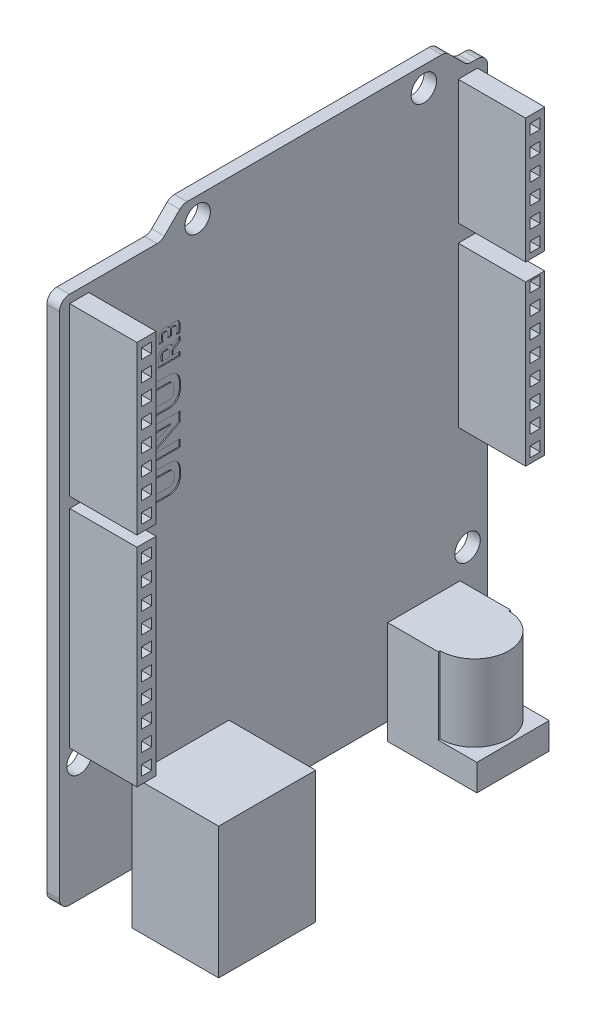
from build123d import *

# Parameters (mm, degrees)
SKETCH1_R                = 1.5875
BOSS_EXTRUDE1_DEPTH      = 1.5748
SKETCH2_W                = 2.3876
SKETCH2_H                = 20.7772
SKETCH2_W_2              = 1.27
SKETCH2_H_2              = 1.27
BOSS_EXTRUDE2_DEPTH      = 8.382
LPATTERN1_COUNT          = 2
LPATTERN1_PITCH          = 22.098
SKETCH3_W                = 8.382
SKETCH3_H                = 2.3876
BOSS_EXTRUDE3_DEPTH      = 5.08
SKETCH4_W                = 1.27
SKETCH4_H                = 1.27
CUT_EXTRUDE1_DEPTH       = 8.382
SKETCH5_W                = 2.3876
SKETCH5_H                = 5.252717845
CUT_EXTRUDE2_DEPTH       = 8.382
SKETCH6_W                = 8.382
SKETCH6_H                = 2.3876
BOSS_EXTRUDE4_DEPTH      = 4.414517846
SKETCH7_W                = 1.27
SKETCH7_H                = 1.27
CUT_EXTRUDE3_DEPTH       = 8.382
SKETCH8_W                = 2.3876
SKETCH8_H                = 5.3086
CUT_EXTRUDE4_DEPTH       = 8.382
BOSS_EXTRUDE5_DEPTH      = 2.159
BOSS_EXTRUDE5_DEPTH_BACK = 1.143
SKETCH9_W                = 11.0998
SKETCH9_H                = 9.017
SKETCH9_R                = 3.175
SKETCH9_R_2              = 0.635
BOSS_EXTRUDE6_DEPTH      = 9.525
BOSS_EXTRUDE7_DEPTH      = 6.35
BOSS_EXTRUDE7_DEPTH_BACK = 10.033
SKETCH11_W               = 10.795
SKETCH11_H               = 12.065
SKETCH12_W               = 3.048
SKETCH12_H               = 5.588
CUT_EXTRUDE5_DEPTH       = 9.144
CUT_EXTRUDE6_DEPTH       = 0.127


with BuildPart() as part:
    # Sketch1 → Boss-Extrude1 (new body)
    with BuildSketch(Plane(origin=(0, 0, 0), x_dir=(0, 0, -1), z_dir=(1, 0, 0))):
        with BuildLine():
            Line((-25.4, 29.380469799), (-14.496051224, 29.380469799))
            ThreePointArc((-14.496051224, 29.380469799), (-14.010043265, 29.477142792), (-13.598025612, 29.752444187))
            Line((-13.598025612, 29.752444187), (-11.674974388, 31.675495411))
            ThreePointArc((-11.674974388, 31.675495411), (-11.262956735, 31.950796805), (-10.776948776, 32.047469799))
            Line((-10.776948776, 32.047469799), (20.936948776, 32.047469799))
            ThreePointArc((20.936948776, 32.047469799), (21.422956735, 31.950796805), (21.834974388, 31.675495411))
            Line((21.834974388, 31.675495411), (23.758025612, 29.752444187))
            ThreePointArc((23.758025612, 29.752444187), (24.170043265, 29.477142792), (24.656051224, 29.380469799))
            Line((24.656051224, 29.380469799), (25.4, 29.380469799))
            ThreePointArc((25.4, 29.380469799), (26.298025612, 29.008495411), (26.67, 28.110469799))
            Line((26.67, 28.110469799), (26.67, -35.262530201))
            ThreePointArc((26.67, -35.262530201), (26.298025612, -36.160555813), (25.4, -36.532530201))
            Line((25.4, -36.532530201), (-25.4, -36.532530201))
            ThreePointArc((-25.4, -36.532530201), (-26.298025612, -36.160555813), (-26.67, -35.262530201))
            Line((-26.67, -35.262530201), (-26.67, 28.110469799))
            ThreePointArc((-26.67, 28.110469799), (-26.298025612, 29.008495411), (-25.4, 29.380469799))
        make_face()
        with Locations((18.7325, 29.545569799)):
            Circle(SKETCH1_R, mode=Mode.SUBTRACT)
        with Locations((-9.4615, 29.545569799)):
            Circle(SKETCH1_R, mode=Mode.SUBTRACT)
        with Locations((24.1681, -22.702230201)):
            Circle(SKETCH1_R, mode=Mode.SUBTRACT)
        with Locations((-24.1681, -21.432230201)):
            Circle(SKETCH1_R, mode=Mode.SUBTRACT)
    extrude(amount=BOSS_EXTRUDE1_DEPTH)

    # Sketch2 → Boss-Extrude2 (add)
    # profile 1 of 2: a face of its own
    with BuildSketch(Plane(origin=(1.5748, 0, 0), x_dir=(0, 0, -1), z_dir=(1, 0, 0))):
        with Locations((-24.2062, 17.975869799)):
            Rectangle(SKETCH2_W, SKETCH2_H)
        with Locations((-24.2062, 24.325869799)):
            Rectangle(SKETCH2_W_2, SKETCH2_H_2, mode=Mode.SUBTRACT)
        with Locations((-24.2062, 26.865869799)):
            Rectangle(SKETCH2_W_2, SKETCH2_H_2, mode=Mode.SUBTRACT)
        with Locations((-24.2062, 21.785869799)):
            Rectangle(SKETCH2_W_2, SKETCH2_H_2, mode=Mode.SUBTRACT)
        with Locations((-24.2062, 19.245869799)):
            Rectangle(SKETCH2_W_2, SKETCH2_H_2, mode=Mode.SUBTRACT)
        with Locations((-24.2062, 16.705869799)):
            Rectangle(SKETCH2_W_2, SKETCH2_H_2, mode=Mode.SUBTRACT)
        with Locations((-24.2062, 14.165869799)):
            Rectangle(SKETCH2_W_2, SKETCH2_H_2, mode=Mode.SUBTRACT)
        with Locations((-24.2062, 11.625869799)):
            Rectangle(SKETCH2_W_2, SKETCH2_H_2, mode=Mode.SUBTRACT)
        with Locations((-24.2062, 9.085869799)):
            Rectangle(SKETCH2_W_2, SKETCH2_H_2, mode=Mode.SUBTRACT)
    # profile 2 of 2: a face of its own
    with BuildSketch(Plane(origin=(1.5748, 0, 0), x_dir=(0, 0, -1), z_dir=(1, 0, 0))):
        with Locations((24.2062, 17.975869799)):
            Rectangle(SKETCH2_W, SKETCH2_H)
        with Locations((24.2062, 24.325869799)):
            Rectangle(SKETCH2_W_2, SKETCH2_H_2, mode=Mode.SUBTRACT)
        with Locations((24.2062, 26.865869799)):
            Rectangle(SKETCH2_W_2, SKETCH2_H_2, mode=Mode.SUBTRACT)
        with Locations((24.2062, 21.785869799)):
            Rectangle(SKETCH2_W_2, SKETCH2_H_2, mode=Mode.SUBTRACT)
        with Locations((24.2062, 19.245869799)):
            Rectangle(SKETCH2_W_2, SKETCH2_H_2, mode=Mode.SUBTRACT)
        with Locations((24.2062, 16.705869799)):
            Rectangle(SKETCH2_W_2, SKETCH2_H_2, mode=Mode.SUBTRACT)
        with Locations((24.2062, 14.165869799)):
            Rectangle(SKETCH2_W_2, SKETCH2_H_2, mode=Mode.SUBTRACT)
        with Locations((24.2062, 11.625869799)):
            Rectangle(SKETCH2_W_2, SKETCH2_H_2, mode=Mode.SUBTRACT)
        with Locations((24.2062, 9.085869799)):
            Rectangle(SKETCH2_W_2, SKETCH2_H_2, mode=Mode.SUBTRACT)
    boss_extrude2 = extrude(amount=BOSS_EXTRUDE2_DEPTH)

    # LPattern1: Boss-Extrude2 ×2
    with Locations(*[(0, -i * LPATTERN1_PITCH, 0) for i in range(1, LPATTERN1_COUNT)]):
        add(boss_extrude2)

    # Sketch3 → Boss-Extrude3 (add)
    with BuildSketch(Plane.XZ.offset(14.510730201)):
        with Locations((5.7658, 24.2062)):
            Rectangle(SKETCH3_W, SKETCH3_H)
    extrude(amount=BOSS_EXTRUDE3_DEPTH)

    # Sketch4 → Cut-Extrude1 (cut)
    with BuildSketch(Plane(origin=(9.9568, 0, 0), x_dir=(0, 0, -1), z_dir=(1, 0, 0))):
        with Locations((-24.2062, -15.552130201)):
            Rectangle(SKETCH4_W, SKETCH4_H)
        with Locations((-24.2062, -18.092130201)):
            Rectangle(SKETCH4_W, SKETCH4_H)
    extrude(amount=-CUT_EXTRUDE1_DEPTH, mode=Mode.SUBTRACT)

    # Sketch5 → Cut-Extrude2 (cut)
    with BuildSketch(Plane(origin=(9.9568, 0, 0), x_dir=(0, 0, -1), z_dir=(1, 0, 0))):
        with Locations((24.2062, 10.213628722)):
            Rectangle(SKETCH5_W, SKETCH5_H)
    extrude(amount=-CUT_EXTRUDE2_DEPTH, mode=Mode.SUBTRACT)

    # Sketch6 → Boss-Extrude4 (add)
    with BuildSketch(Plane(origin=(0, 6.266469799, 0), x_dir=(1, 0, 0), z_dir=(0, 1, 0))):
        with Locations((5.7658, 24.2062)):
            Rectangle(SKETCH6_W, SKETCH6_H)
    extrude(amount=BOSS_EXTRUDE4_DEPTH)

    # Sketch7 → Cut-Extrude3 (cut)
    with BuildSketch(Plane(origin=(9.9568, 0, 0), x_dir=(0, 0, -1), z_dir=(1, 0, 0))):
        with Locations((24.2062, 7.307869799)):
            Rectangle(SKETCH7_W, SKETCH7_H)
        with Locations((24.2062, 9.847869799)):
            Rectangle(SKETCH7_W, SKETCH7_H)
    extrude(amount=-CUT_EXTRUDE3_DEPTH, mode=Mode.SUBTRACT)

    # Sketch8 → Cut-Extrude4 (cut)
    with BuildSketch(Plane(origin=(9.9568, 0, 0), x_dir=(0, 0, -1), z_dir=(1, 0, 0))):
        with Locations((24.2062, -11.856430201)):
            Rectangle(SKETCH8_W, SKETCH8_H)
    extrude(amount=-CUT_EXTRUDE4_DEPTH, mode=Mode.SUBTRACT)

    # Sketch9 → Boss-Extrude5 (add, two sides: drawn at the far end of the back side and taken through both)
    # profile 1 of 2: a face of its own
    with BuildSketch(Plane.XZ.offset(36.532530201).offset(-BOSS_EXTRUDE5_DEPTH_BACK)):
        with Locations((7.1247, -18.7325)):
            Rectangle(SKETCH9_W, SKETCH9_H)
        with Locations(Location((7.874, -18.7325, 0), (0, 0, 270))):
            Circle(SKETCH9_R, mode=Mode.SUBTRACT)
    # profile 2 of 2: a face of its own
    with BuildSketch(Plane.XZ.offset(36.532530201).offset(-BOSS_EXTRUDE5_DEPTH_BACK)):
        with Locations(Location((7.874, -18.7325, 0), (0, 0, 270))):
            Circle(SKETCH9_R_2)
    extrude(amount=BOSS_EXTRUDE5_DEPTH + BOSS_EXTRUDE5_DEPTH_BACK)


with BuildPart() as boss_extrude5_piece_1:
    # of the separate pieces the step leaves, piece 1, a body of its own (boss_extrude5_pieces)
    add(part.part.solids().sort_by_distance((0, -35.262530201, 26.67))[0])



with BuildPart() as boss_extrude5_piece_2:
    # of the separate pieces the step leaves, piece 2, a body of its own (boss_extrude5_pieces)
    add(part.part.solids().sort_by_distance((7.874, -36.532530201, -19.3675))[0])


with BuildPart() as boss_extrude5_piece_1_1:
    add(boss_extrude5_piece_1.part)

    add(boss_extrude5_piece_2.part)  # Boss-Extrude6 merges Boss-Extrude5 piece 2
    # Sketch10 → Boss-Extrude6 (add)
    with BuildSketch(Plane(origin=(0, -35.389530201, 0), x_dir=(1, 0, 0), z_dir=(0, 1, 0))):
        with BuildLine():
            Line((7.874, 23.241), (1.5748, 23.241))
            Line((1.5748, 23.241), (1.5748, 14.224))
            Line((1.5748, 14.224), (7.874, 14.224))
            Line((7.874, 14.224), (7.874, 14.4526))
            ThreePointArc((7.874, 14.4526), (12.1539, 18.7325), (7.874, 23.0124))
            Line((7.874, 23.0124), (7.874, 23.241))
        make_face()
    extrude(amount=BOSS_EXTRUDE6_DEPTH)

    # Sketch11 → Boss-Extrude7 (add, two sides: drawn at the far end of the back side and taken through both)
    with BuildSketch(Plane.XZ.offset(36.532530201).offset(-BOSS_EXTRUDE7_DEPTH_BACK)):
        with Locations((6.9723, 11.5951)):
            Rectangle(SKETCH11_W, SKETCH11_H)
    extrude(amount=BOSS_EXTRUDE7_DEPTH + BOSS_EXTRUDE7_DEPTH_BACK)

    # Sketch12 → Cut-Extrude5 (cut)
    with BuildSketch(Plane.XZ.offset(42.882530201)):
        Polygon((3.3528, 15.8496), (3.3528, 7.3406), (8.9408, 7.3406), (11.0998, 9.4996), (11.0998, 13.6906), (8.9408, 15.8496), align=None)
        with Locations((7.2263, 11.5951)):
            Rectangle(SKETCH12_W, SKETCH12_H, mode=Mode.SUBTRACT)
    extrude(amount=-CUT_EXTRUDE5_DEPTH, mode=Mode.SUBTRACT)

    # Sketch13 → Cut-Extrude6 (cut)
    # profile 1 of 5: a face of its own
    with BuildSketch(Plane(origin=(1.5748, 0, 0), x_dir=(0, 0, -1), z_dir=(1, 0, 0))):
        with BuildLine():
            Line((-16.40418539, 4.076653632), (-13.090824439, 4.082271085))
            add(Edge.make_bspline(
                [(-13.090824439, 4.082271085), (-13.062772283, 4.081770767), (-13.007698506, 4.08078851), (-12.927417633, 4.074398088), (-12.851959787, 4.059377479), (-12.781451069, 4.038986256), (-12.715794501, 4.011983852), (-12.655279387, 3.978737583), (-12.600057551, 3.939079129), (-12.54939075, 3.893051575), (-12.504657413, 3.838773297), (-12.466196867, 3.775987512), (-12.434329045, 3.70478736), (-12.407474606, 3.625397291), (-12.385487075, 3.537559883), (-12.371980641, 3.44072242), (-12.362360933, 3.335675572), (-12.360549862, 3.262695941), (-12.359607191, 3.224709678)],
                knots=[0, 0, 0, 0, 1.036768829, 2.035450589, 2.970817006, 3.874706733, 4.743834239, 5.588575961, 6.420221623, 7.250595281, 8.111072666, 9.010001133, 9.963021592, 10.987346692, 12.103888637, 13.303221002, 14.596313033, 16, 16, 16, 16], degree=3))
            add(Edge.make_bspline(
                [(-12.359607191, 3.224709678), (-12.360109464, 3.18672103), (-12.361074571, 3.113726702), (-12.371031456, 3.008352007), (-12.384502403, 2.911619152), (-12.405503525, 2.823292235), (-12.432087884, 2.743879388), (-12.464131158, 2.672394919), (-12.502599185, 2.60963015), (-12.547269011, 2.555260775), (-12.598323729, 2.509427731), (-12.652839516, 2.468434146), (-12.713541668, 2.43569978), (-12.778577073, 2.408125354), (-12.848867153, 2.387928877), (-12.924371247, 2.373292098), (-13.004773083, 2.365058932), (-13.060159507, 2.364592282), (-13.088476756, 2.3643537)],
                knots=[0, 0, 0, 0, 1.401962011, 2.693838237, 3.90464286, 5.004750184, 6.040174875, 6.992299275, 7.890382541, 8.750050878, 9.579643793, 10.417995117, 11.261942587, 12.118489834, 13.021529696, 13.956016653, 14.954978808, 16, 16, 16, 16], degree=3))
            Line((-13.088476756, 2.3643537), (-16.401273535, 2.359144716))
            Line((-16.401273535, 2.359144716), (-16.399744812, 1.457452535))
            Line((-16.399744812, 1.457452535), (-13.014820989, 1.463191315))
            add(Edge.make_bspline(
                [(-13.014820989, 1.463191315), (-12.966853572, 1.463036625), (-12.872657858, 1.462732853), (-12.733739321, 1.479232635), (-12.599670999, 1.506562947), (-12.470739862, 1.548448765), (-12.346810441, 1.602880922), (-12.22712498, 1.668686427), (-12.114153614, 1.75000039), (-12.004530867, 1.841176239), (-11.903806044, 1.949650865), (-11.816817506, 2.077658823), (-11.741634575, 2.223885724), (-11.682208628, 2.389341281), (-11.631618785, 2.571841124), (-11.596396573, 2.773278425), (-11.574015792, 2.993365906), (-11.568418706, 3.146316291), (-11.565512082, 3.225745004)],
                knots=[0, 0, 0, 0, 0.886673269, 1.741199073, 2.582650024, 3.41450301, 4.24363194, 5.083895205, 5.935936917, 6.814732091, 7.718362947, 8.664049487, 9.669161808, 10.751937351, 11.910496383, 13.169091037, 14.529879771, 16, 16, 16, 16], degree=3))
            add(Edge.make_bspline(
                [(-11.565512082, 3.225745004), (-11.568201262, 3.305189777), (-11.573370546, 3.457902696), (-11.598585977, 3.677573493), (-11.635721323, 3.87850108), (-11.682643847, 4.062029728), (-11.74687213, 4.225568247), (-11.820799105, 4.371777075), (-11.907904731, 4.500171812), (-12.009808698, 4.607774419), (-12.11901507, 4.700000539), (-12.233401318, 4.778921949), (-12.35212662, 4.845787682), (-12.476029058, 4.900390848), (-12.605797176, 4.940303433), (-12.739915119, 4.968208611), (-12.878924447, 4.984698927), (-12.973166497, 4.984056169), (-13.02118056, 4.9837287)],
                knots=[0, 0, 0, 0, 1.470244897, 2.826182015, 4.086032713, 5.249185149, 6.324647945, 7.3298455, 8.275612236, 9.183662708, 10.062532404, 10.916223785, 11.750984813, 12.580184055, 13.416262704, 14.257785011, 15.112383279, 16, 16, 16, 16], degree=3))
            Line((-13.02118056, 4.9837287), (-16.405714114, 4.978345813))
            Line((-16.405714114, 4.978345813), (-16.40418539, 4.076653632))
        make_face()
    # profile 2 of 5: a face of its own
    with BuildSketch(Plane(origin=(1.5748, 0, 0), x_dir=(0, 0, -1), z_dir=(1, 0, 0))):
        Polygon((-11.644466518, 8.697813219), (-11.646504816, 9.900069461), (-16.412592059, 9.891989064), (-16.411099734, 9.011765745), (-12.790018435, 9.017904905), (-16.408030154, 7.201225095), (-16.405991855, 5.998968854), (-11.639904612, 6.00704925), (-11.641396938, 6.88727257), (-15.255321949, 6.881145543), align=None)
    # profile 3 of 5: a face of its own
    with BuildSketch(Plane(origin=(1.5748, 0, 0), x_dir=(0, 0, -1), z_dir=(1, 0, 0))):
        with BuildLine():
            add(Edge.make_bspline(
                [(-15.023271978, 14.470319686), (-15.073638817, 14.469996741), (-15.172368099, 14.469363701), (-15.317182843, 14.450962491), (-15.455730255, 14.420795878), (-15.588973861, 14.379235728), (-15.714808804, 14.320773919), (-15.835629374, 14.252044861), (-15.948979358, 14.167658881), (-16.057385101, 14.071882397), (-16.157018407, 13.959282829), (-16.243001647, 13.827687643), (-16.315203832, 13.677632997), (-16.376563087, 13.510325215), (-16.423184965, 13.324171867), (-16.458041253, 13.120319482), (-16.480842032, 12.898236319), (-16.485579016, 12.743889796), (-16.48803798, 12.663768682)],
                knots=[0, 0, 0, 0, 0.913462901, 1.79057365, 2.643189391, 3.485039204, 4.317540177, 5.156589261, 6.003457043, 6.877319016, 7.778237269, 8.723275687, 9.720507335, 10.79450682, 11.952098766, 13.198074651, 14.545523574, 16, 16, 16, 16], degree=3))
            add(Edge.make_bspline(
                [(-16.48803798, 12.663768682), (-16.485269926, 12.583980676), (-16.47992568, 12.429934967), (-16.455580598, 12.208354636), (-16.421574057, 12.004196178), (-16.373063135, 11.818453788), (-16.312398029, 11.65064921), (-16.238950541, 11.501301885), (-16.152634865, 11.370135167), (-16.05316867, 11.257845299), (-15.945114339, 11.161416574), (-15.830145518, 11.079221761), (-15.709810411, 11.009073038), (-15.582734692, 10.953616347), (-15.450378519, 10.908769401), (-15.311158377, 10.881088797), (-15.166397429, 10.863336), (-15.067971163, 10.863336409), (-15.017874936, 10.863336617)],
                knots=[0, 0, 0, 0, 1.44910639, 2.797771635, 4.04426638, 5.203915865, 6.278362595, 7.278780301, 8.218985791, 9.120279213, 9.994505087, 10.843114719, 11.682513208, 12.518513546, 13.356694972, 14.214485498, 15.091222876, 16, 16, 16, 16], degree=3))
            Line((-15.017874936, 10.863336617), (-13.042021829, 10.866899594))
            add(Edge.make_bspline(
                [(-13.042021829, 10.866899594), (-12.992074862, 10.8666451), (-12.893753183, 10.866144122), (-12.749379008, 10.884951453), (-12.610828835, 10.914999563), (-12.477585907, 10.956590683), (-12.351750948, 11.015044386), (-12.23092977, 11.083775324), (-12.117582286, 11.168161946), (-12.009166756, 11.263933755), (-11.909571953, 11.376552318), (-11.823263907, 11.508331633), (-11.751613893, 11.659009078), (-11.690146965, 11.82621187), (-11.643091414, 12.012279035), (-11.608657209, 12.216216496), (-11.58572813, 12.438270372), (-11.580980865, 12.592273964), (-11.578521675, 12.672051291)],
                knots=[0, 0, 0, 0, 0.906092042, 1.783661674, 2.636723482, 3.47901373, 4.311950247, 5.151438301, 5.998749144, 6.873068299, 7.774457891, 8.71999073, 9.723376461, 10.797937837, 11.95006692, 13.20286967, 14.551023545, 16, 16, 16, 16], degree=3))
            add(Edge.make_bspline(
                [(-11.578521675, 12.672051291), (-11.581449699, 12.752163835), (-11.587089761, 12.906479404), (-11.609204188, 13.128708495), (-11.645447586, 13.332509682), (-11.693119113, 13.518182079), (-11.754711058, 13.685626412), (-11.827277952, 13.835368614), (-11.913965665, 13.966699341), (-12.013377172, 14.079023393), (-12.121461008, 14.175406375), (-12.236366338, 14.257745951), (-12.357045114, 14.32743963), (-12.483341033, 14.384842123), (-12.616438278, 14.427674291), (-12.755359398, 14.45588582), (-12.900173242, 14.473487913), (-12.998592208, 14.473508304), (-13.048684719, 14.473518682)],
                knots=[0, 0, 0, 0, 1.454725837, 2.802143478, 4.049176214, 5.208316077, 6.276411913, 7.28200375, 8.221796055, 9.122693393, 9.996535077, 10.844771777, 11.683801382, 12.521988963, 13.357856606, 14.215270164, 15.091622249, 16, 16, 16, 16], degree=3))
            Line((-13.048684719, 14.473518682), (-15.023271978, 14.470319686))
        make_face()
        with BuildLine():
            add(Edge.make_bspline(
                [(-14.968591797, 11.765328072), (-14.99642465, 11.76503768), (-15.05030174, 11.764475556), (-15.128963497, 11.772897171), (-15.202492627, 11.788981108), (-15.272325738, 11.808907093), (-15.337092166, 11.837051604), (-15.396424395, 11.87286686), (-15.451536064, 11.914204034), (-15.502077051, 11.962428138), (-15.547232867, 12.01884782), (-15.58499106, 12.084932546), (-15.618820507, 12.15917695), (-15.645035954, 12.243093377), (-15.665461403, 12.335991959), (-15.680980533, 12.437297552), (-15.69004206, 12.547999551), (-15.691925049, 12.624754974), (-15.692907545, 12.664804008)],
                knots=[0, 0, 0, 0, 1.005017582, 1.945449934, 2.85024458, 3.722050096, 4.565210484, 5.392738205, 6.220641562, 7.049577042, 7.910255726, 8.821214826, 9.79222772, 10.852918712, 11.990277154, 13.226407482, 14.552809739, 16, 16, 16, 16], degree=3))
            add(Edge.make_bspline(
                [(-15.692907545, 12.664804008), (-15.692401918, 12.70486309), (-15.691428403, 12.781991309), (-15.681522525, 12.892869844), (-15.668163833, 12.995245101), (-15.64574852, 13.087638379), (-15.620765276, 13.172180432), (-15.587264745, 13.246504093), (-15.549292403, 13.312823589), (-15.504149859, 13.369250322), (-15.453608411, 13.417481954), (-15.398486138, 13.458782692), (-15.339197017, 13.494737043), (-15.274474482, 13.522256817), (-15.205523069, 13.544242201), (-15.132028928, 13.559758853), (-15.053613497, 13.567942666), (-14.999947522, 13.568405446), (-14.972320588, 13.568643682)],
                knots=[0, 0, 0, 0, 1.446325069, 2.784698753, 4.018586844, 5.170492991, 6.215179291, 7.197240573, 8.107891679, 8.968279368, 9.796934586, 10.62455803, 11.451805965, 12.294681281, 13.15795316, 14.062441895, 15.002556289, 16, 16, 16, 16], degree=3))
            Line((-14.972320588, 13.568643682), (-13.09670201, 13.571891209))
            add(Edge.make_bspline(
                [(-13.09670201, 13.571891209), (-13.069292602, 13.571999602), (-13.015498233, 13.572212336), (-12.936904133, 13.564043685), (-12.863320195, 13.548051196), (-12.793956183, 13.527729516), (-12.729460592, 13.499826215), (-12.670137169, 13.463982432), (-12.615022796, 13.42265294), (-12.564483895, 13.374426447), (-12.519322142, 13.318008672), (-12.481587406, 13.251918373), (-12.447661019, 13.177696401), (-12.421831733, 13.093611334), (-12.399685601, 13.001030401), (-12.384588744, 12.899191937), (-12.375496371, 12.788168803), (-12.373601217, 12.711066558), (-12.372616784, 12.671015965)],
                knots=[0, 0, 0, 0, 0.989796482, 1.942598557, 2.847365444, 3.70720455, 4.55033907, 5.377841403, 6.205719361, 7.034629411, 7.895281689, 8.806212843, 9.777195947, 10.837854398, 11.977976466, 13.214068871, 14.552854137, 16, 16, 16, 16], degree=3))
            add(Edge.make_bspline(
                [(-12.372616784, 12.671015965), (-12.373172186, 12.630965315), (-12.374241535, 12.553853331), (-12.383491085, 12.442812512), (-12.399033333, 12.34117523), (-12.419405491, 12.248247876), (-12.445929167, 12.164126522), (-12.479220033, 12.089293928), (-12.517285809, 12.023002413), (-12.562404079, 11.966565792), (-12.612956554, 11.91834744), (-12.668057871, 11.877003338), (-12.727149112, 11.841373793), (-12.791575164, 11.81317558), (-12.860634335, 11.791483201), (-12.934660089, 11.777418416), (-13.012929662, 11.76882296), (-13.066606527, 11.768419378), (-13.094239067, 11.768211617)],
                knots=[0, 0, 0, 0, 1.44627833, 2.784608763, 4.020281224, 5.157218384, 6.217516492, 7.199546038, 8.110167716, 8.970527601, 9.799156041, 10.62675274, 11.453973941, 12.285409713, 13.160538882, 14.062504509, 15.002588522, 16, 16, 16, 16], degree=3))
            Line((-13.094239067, 11.768211617), (-14.968591797, 11.765328072))
        make_face(mode=Mode.SUBTRACT)
    # profile 4 of 5: a face of its own
    with BuildSketch(Plane(origin=(1.5748, 0, 0), x_dir=(0, 0, -1), z_dir=(1, 0, 0))):
        with BuildLine():
            Line((-11.657066115, 18.048879258), (-12.602174138, 17.391282053))
            add(Edge.make_bspline(
                [(-12.602174138, 17.391282053), (-12.608758835, 17.407910165), (-12.621722511, 17.440646894), (-12.644756823, 17.487303417), (-12.670631916, 17.530656438), (-12.699508491, 17.570337346), (-12.730654007, 17.606885634), (-12.764530859, 17.639916111), (-12.801832177, 17.66850686), (-12.854282885, 17.703710088), (-12.927989812, 17.738071318), (-13.0246461, 17.767275865), (-13.130760129, 17.785618934), (-13.204805831, 17.786994099), (-13.243229268, 17.787707693)],
                knots=[0, 0, 0, 0, 0.793694091, 1.562591577, 2.307027753, 3.032289832, 3.738523999, 4.436763292, 5.128016366, 5.822041052, 7.2381973, 8.716253066, 10.296013984, 12, 12, 12, 12], degree=3))
            Line((-13.243229268, 17.787707693), (-13.588825519, 17.787181941))
            add(Edge.make_bspline(
                [(-13.588825519, 17.787181941), (-13.617245839, 17.78681126), (-13.672264703, 17.78609366), (-13.75245098, 17.778260384), (-13.827089218, 17.763213791), (-13.896792908, 17.742679811), (-13.961093917, 17.715553694), (-14.019974846, 17.682146945), (-14.073757035, 17.642470829), (-14.122318211, 17.596322939), (-14.165503749, 17.542704649), (-14.20233896, 17.480788315), (-14.234082064, 17.411055659), (-14.258870184, 17.332690618), (-14.279079351, 17.246770833), (-14.293094204, 17.152701962), (-14.301816672, 17.050491193), (-14.302785054, 16.979597189), (-14.303288144, 16.94276657)],
                knots=[0, 0, 0, 0, 1.06937014, 2.070192402, 3.026757312, 3.930716698, 4.800452265, 5.647074854, 6.472525414, 7.309500273, 8.161394765, 9.054810976, 10.013821861, 11.038318312, 12.142660067, 13.332506656, 14.614192637, 16, 16, 16, 16], degree=3))
            Line((-14.303288144, 16.94276657), (-14.301185138, 15.857746853))
            Line((-14.301185138, 15.857746853), (-11.653358892, 15.862235962))
            Line((-11.653358892, 15.862235962), (-11.654208183, 16.363176062))
            Line((-11.654208183, 16.363176062), (-12.528865502, 16.361693173))
            Line((-12.528865502, 16.361693173), (-12.52967435, 16.838778984))
            Line((-12.52967435, 16.838778984), (-11.656048313, 17.44854628))
            Line((-11.656048313, 17.44854628), (-11.657066115, 18.048879258))
        make_face()
        with BuildLine():
            Line((-13.548219077, 17.286309245), (-13.285821882, 17.286754111))
            add(Edge.make_bspline(
                [(-13.285821882, 17.286754111), (-13.260065426, 17.286176949), (-13.211580163, 17.285090469), (-13.143570979, 17.271854494), (-13.086213373, 17.246948279), (-13.04671797, 17.216838718), (-13.022063551, 17.186764099), (-13.006545107, 17.160165568), (-12.992693795, 17.130440923), (-12.981716999, 17.096645834), (-12.974143893, 17.058950442), (-12.967538495, 17.017740935), (-12.964339454, 16.972534374), (-12.963913213, 16.941236206), (-12.963691224, 16.924935954)],
                knots=[0, 0, 0, 0, 1.640982154, 3.089068241, 4.386143619, 5.596625776, 6.21333222, 6.854861616, 7.554980054, 8.301081242, 9.11390212, 10.004285997, 10.960621556, 12, 12, 12, 12], degree=3))
            Line((-12.963691224, 16.924935954), (-12.962218446, 16.360958469))
            Line((-12.962218446, 16.360958469), (-13.860730055, 16.359435138))
            Line((-13.860730055, 16.359435138), (-13.861687192, 16.92398668))
            add(Edge.make_bspline(
                [(-13.861687192, 16.92398668), (-13.861596748, 16.939834854), (-13.861422968, 16.970285851), (-13.85881337, 17.014264326), (-13.852857596, 17.054767568), (-13.845231429, 17.091799625), (-13.83461947, 17.125247998), (-13.822122747, 17.155206781), (-13.807317157, 17.181851589), (-13.783915059, 17.21239435), (-13.746072256, 17.243622899), (-13.68987348, 17.269520023), (-13.622634037, 17.284244137), (-13.574419365, 17.285485996), (-13.548219077, 17.286309245)],
                knots=[0, 0, 0, 0, 1.024136574, 1.967796489, 2.843887203, 3.66769203, 4.408286702, 5.107843902, 5.76251291, 6.372136087, 7.585703572, 8.88810605, 10.33681152, 12, 12, 12, 12], degree=3))
        make_face(mode=Mode.SUBTRACT)
    # profile 5 of 5: a face of its own
    with BuildSketch(Plane(origin=(1.5748, 0, 0), x_dir=(0, 0, -1), z_dir=(1, 0, 0))):
        with BuildLine():
            add(Edge.make_bspline(
                [(-11.70046121, 18.339578106), (-11.69413663, 18.361469085), (-11.680837033, 18.407502364), (-11.665389258, 18.481303626), (-11.650577508, 18.562333498), (-11.640144968, 18.649055295), (-11.63025424, 18.736443424), (-11.623338028, 18.82083775), (-11.619054435, 18.899867966), (-11.618632353, 18.950908376), (-11.618429368, 18.975454358)],
                knots=[0, 0, 0, 0, 0.850196575, 1.787829387, 2.812568754, 3.923854085, 5.046805751, 6.095111103, 7.083914684, 8, 8, 8, 8], degree=3))
            add(Edge.make_bspline(
                [(-11.618429368, 18.975454358), (-11.619213594, 19.016114744), (-11.620717041, 19.094065048), (-11.628703156, 19.206198285), (-11.64146596, 19.308467522), (-11.660008354, 19.401044946), (-11.682365151, 19.484048677), (-11.710531742, 19.557215669), (-11.743715158, 19.620676667), (-11.782796631, 19.67448753), (-11.826867103, 19.719685798), (-11.873898494, 19.759272567), (-11.925850407, 19.79176682), (-11.982082169, 19.817852749), (-12.042859951, 19.83709636), (-12.107502155, 19.851166244), (-12.176591157, 19.85798894), (-12.223892391, 19.857472859), (-12.248252737, 19.857207076)],
                knots=[0, 0, 0, 0, 1.564120406, 2.998585903, 4.322244677, 5.525608937, 6.627815916, 7.624856675, 8.535449388, 9.374804305, 10.172836403, 10.958470131, 11.733965326, 12.522570369, 13.336528242, 14.181276634, 15.063349347, 16, 16, 16, 16], degree=3))
            Line((-12.248252737, 19.857207076), (-12.474324771, 19.856993629))
            add(Edge.make_bspline(
                [(-12.474324771, 19.856993629), (-12.506026184, 19.855976894), (-12.566213456, 19.854046554), (-12.650849063, 19.838510731), (-12.725218529, 19.813630345), (-12.788739592, 19.776521096), (-12.843195549, 19.72860549), (-12.888410449, 19.669297435), (-12.927877749, 19.600301529), (-12.945822619, 19.548699338), (-12.955150382, 19.52187646)],
                knots=[0, 0, 0, 0, 1.193684615, 2.266290832, 3.230434162, 4.133680942, 5.019188961, 5.945512243, 6.932074908, 8, 8, 8, 8], degree=3))
            add(Edge.make_bspline(
                [(-12.955150382, 19.52187646), (-12.966298915, 19.546065024), (-12.987731233, 19.592565942), (-13.030639071, 19.653270228), (-13.077643349, 19.704791969), (-13.133005914, 19.744133162), (-13.195611583, 19.774078597), (-13.267479651, 19.794619412), (-13.348994528, 19.805598324), (-13.406442837, 19.806626822), (-13.436577013, 19.807166315)],
                knots=[0, 0, 0, 0, 1.060304835, 2.038366071, 2.952722972, 3.829357715, 4.72901069, 5.709192727, 6.798370406, 8, 8, 8, 8], degree=3))
            Line((-13.436577013, 19.807166315), (-13.682861272, 19.807235966))
            add(Edge.make_bspline(
                [(-13.682861272, 19.807235966), (-13.706040055, 19.807259963), (-13.750826184, 19.807306332), (-13.8159398, 19.800334002), (-13.876528371, 19.787519213), (-13.933695189, 19.770184469), (-13.985923141, 19.745037248), (-14.034330497, 19.714959512), (-14.078296608, 19.679097263), (-14.118153071, 19.636936326), (-14.153596589, 19.587374135), (-14.18427239, 19.529203812), (-14.20889816, 19.461854403), (-14.230453222, 19.386398875), (-14.245877824, 19.301777389), (-14.258124772, 19.208710028), (-14.264736289, 19.106690798), (-14.265560049, 19.035856798), (-14.265988245, 18.999036786)],
                knots=[0, 0, 0, 0, 0.967292088, 1.869005244, 2.727802436, 3.550625719, 4.356331618, 5.140391158, 5.925553311, 6.718350405, 7.555878805, 8.461881384, 9.455041678, 10.544748151, 11.734805684, 13.042497557, 14.462669381, 16, 16, 16, 16], degree=3))
            add(Edge.make_bspline(
                [(-14.265988245, 18.999036786), (-14.264867523, 18.94187947), (-14.262630148, 18.827772278), (-14.25086623, 18.686345317), (-14.235881615, 18.576554811), (-14.224217905, 18.498550761), (-14.209713516, 18.425163199), (-14.198808372, 18.377814968), (-14.193515419, 18.354833887)],
                knots=[0, 0, 0, 0, 1.583739113, 3.16173045, 3.928042129, 4.653805482, 5.346606943, 6, 6, 6, 6], degree=3))
            Line((-14.193515419, 18.354833887), (-13.783857242, 18.407609005))
            add(Edge.make_bspline(
                [(-13.783857242, 18.407609005), (-13.792035501, 18.450528063), (-13.808682426, 18.537890224), (-13.825241914, 18.672607055), (-13.837274995, 18.81247342), (-13.839697666, 18.907557055), (-13.840929368, 18.955898199)],
                knots=[0, 0, 0, 0, 0.949545945, 1.93281005, 2.949027076, 4, 4, 4, 4], degree=3))
            add(Edge.make_bspline(
                [(-13.840929368, 18.955898199), (-13.841136838, 18.972391502), (-13.841535137, 19.004055039), (-13.838798509, 19.049689669), (-13.835737299, 19.091571471), (-13.83050478, 19.129582041), (-13.824022564, 19.163778727), (-13.814441755, 19.193769775), (-13.804475211, 19.22039674), (-13.788597231, 19.250398497), (-13.761146651, 19.281673076), (-13.71599677, 19.306884092), (-13.660587189, 19.32093474), (-13.620338632, 19.321816339), (-13.5987781, 19.322288597)],
                knots=[0, 0, 0, 0, 1.157970122, 2.22304951, 3.209292128, 4.106191287, 4.916877726, 5.649440352, 6.31455087, 6.910965659, 8.026918034, 9.179316621, 10.48900334, 12, 12, 12, 12], degree=3))
            Line((-13.5987781, 19.322288597), (-13.443496038, 19.322603149))
            add(Edge.make_bspline(
                [(-13.443496038, 19.322603149), (-13.421788149, 19.322373576), (-13.380735426, 19.32193942), (-13.322962646, 19.31153105), (-13.273731663, 19.29118052), (-13.239361174, 19.266225938), (-13.217646101, 19.240368755), (-13.203202372, 19.217194086), (-13.191350342, 19.190000402), (-13.18143874, 19.158995879), (-13.174232494, 19.124082318), (-13.169241768, 19.085041335), (-13.165654668, 19.042240727), (-13.165283803, 19.012274082), (-13.165091505, 18.996736061)],
                knots=[0, 0, 0, 0, 1.555232006, 2.941166301, 4.179593689, 5.348210076, 5.943216884, 6.59172894, 7.299472593, 8.064705703, 8.9221933, 9.851611443, 10.88603791, 12, 12, 12, 12], degree=3))
            Line((-13.165091505, 18.996736061), (-13.16382768, 18.516004816))
            Line((-13.16382768, 18.516004816), (-12.730474735, 18.51673952))
            Line((-12.730474735, 18.51673952), (-12.731438613, 19.085266777))
            add(Edge.make_bspline(
                [(-12.731438613, 19.085266777), (-12.731599135, 19.108153417), (-12.731901884, 19.151318529), (-12.721136086, 19.211090929), (-12.705276067, 19.262161008), (-12.679940997, 19.303911581), (-12.644156357, 19.335805939), (-12.597875783, 19.357955173), (-12.541045866, 19.369940302), (-12.499855907, 19.371120686), (-12.47775002, 19.371754177)],
                knots=[0, 0, 0, 0, 1.227138392, 2.314431658, 3.249382197, 4.086920799, 4.903934663, 5.78849247, 6.813124924, 8, 8, 8, 8], degree=3))
            Line((-12.47775002, 19.371754177), (-12.322425269, 19.372212524))
            add(Edge.make_bspline(
                [(-12.322425269, 19.372212524), (-12.298790222, 19.372397024), (-12.254690482, 19.372741275), (-12.193447747, 19.359796926), (-12.142707079, 19.335395609), (-12.109731684, 19.304204056), (-12.08998298, 19.272725531), (-12.077590843, 19.243485694), (-12.066686662, 19.209208223), (-12.057623034, 19.169591035), (-12.0507972, 19.12441108), (-12.046575402, 19.073876083), (-12.043472063, 19.018056233), (-12.043482696, 18.979102181), (-12.043488245, 18.958774105)],
                knots=[0, 0, 0, 0, 1.447684357, 2.701179605, 3.806414872, 4.863549502, 5.434896872, 6.077761975, 6.807218011, 7.64078881, 8.569530078, 9.609427123, 10.752485414, 12, 12, 12, 12], degree=3))
            add(Edge.make_bspline(
                [(-12.043488245, 18.958774105), (-12.044118146, 18.91216258), (-12.045387431, 18.818237967), (-12.05688123, 18.676765031), (-12.074929525, 18.533686231), (-12.093021931, 18.438536087), (-12.102156723, 18.390495119)],
                knots=[0, 0, 0, 0, 0.97731509, 1.969340065, 2.974727038, 4, 4, 4, 4], degree=3))
            Line((-12.102156723, 18.390495119), (-11.70046121, 18.339578106))
        make_face()
    extrude(amount=-CUT_EXTRUDE6_DEPTH, mode=Mode.SUBTRACT)


solid = boss_extrude5_piece_1_1.part
